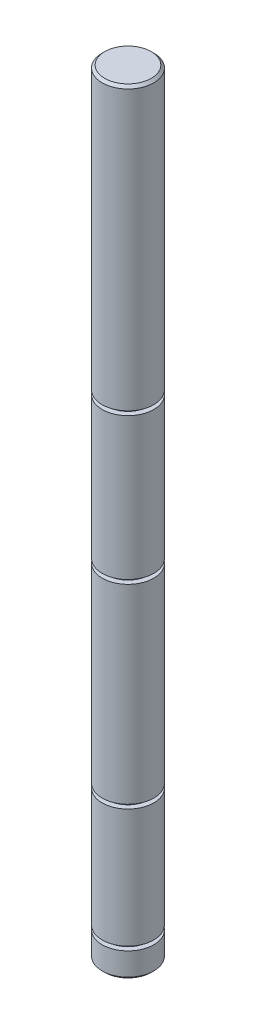
from build123d import *

# Parameters (mm, degrees)
SKETCH1_R           = 5
BOSS_EXTRUDE1_DEPTH = 150
CHAMFER1_SIZE       = 0.5
SKETCH2_W           = 1
SKETCH2_H           = 0.8
LPATTERN1_COUNT     = 2
LPATTERN1_PITCH     = 28.3
SKETCH3_W           = 1
SKETCH3_H           = 0.8


with BuildPart() as part:
    # Sketch1 → Boss-Extrude1 (new body)
    with BuildSketch(Plane(origin=(0, 0, 0), x_dir=(1, 0, 0), z_dir=(0, 1, 0))):
        with Locations(Location((0, 0, 0), (0, 0, 270))):
            Circle(SKETCH1_R)
    extrude(amount=BOSS_EXTRUDE1_DEPTH)

    # Chamfer1
    chamfer1_edges = [part.edges().sort_by_distance(p)[0] for p in [
        (0, 0, -5),
        (0, 150, -5),
    ]]
    chamfer(chamfer1_edges, length=CHAMFER1_SIZE)

    # Sketch2 → Cut-Revolve1 (revolve, cut)
    with BuildSketch(Plane.XY, mode=Mode.PRIVATE) as cut_revolve1_sk:
        with Locations((-4.5, 66.8)):
            Rectangle(SKETCH2_W, SKETCH2_H)
    cut_revolve1 = revolve(cut_revolve1_sk.sketch.rotate(Axis((0, 141.907824912, 0), (0, -1, 0)), 270), axis=Axis((0, 141.907824912, 0), (0, -1, 0)), mode=Mode.SUBTRACT)

    # LPattern1: Cut-Revolve1 ×2
    with Locations(*[(0, i * LPATTERN1_PITCH, 0) for i in range(1, LPATTERN1_COUNT)]):
        add(cut_revolve1, mode=Mode.SUBTRACT)

    # Sketch3 → Cut-Revolve2 (revolve, cut)
    with BuildSketch(Plane.XY, mode=Mode.PRIVATE) as cut_revolve2_sk:
        with Locations((-4.5, 5.3)):
            Rectangle(SKETCH3_W, SKETCH3_H)
        with Locations((-4.5, 29.1)):
            Rectangle(SKETCH3_W, SKETCH3_H)
    revolve(cut_revolve2_sk.sketch.rotate(Axis((0, 152.904561978, 0), (0, -1, 0)), 270), axis=Axis((0, 152.904561978, 0), (0, -1, 0)), mode=Mode.SUBTRACT)


solid = part.part
